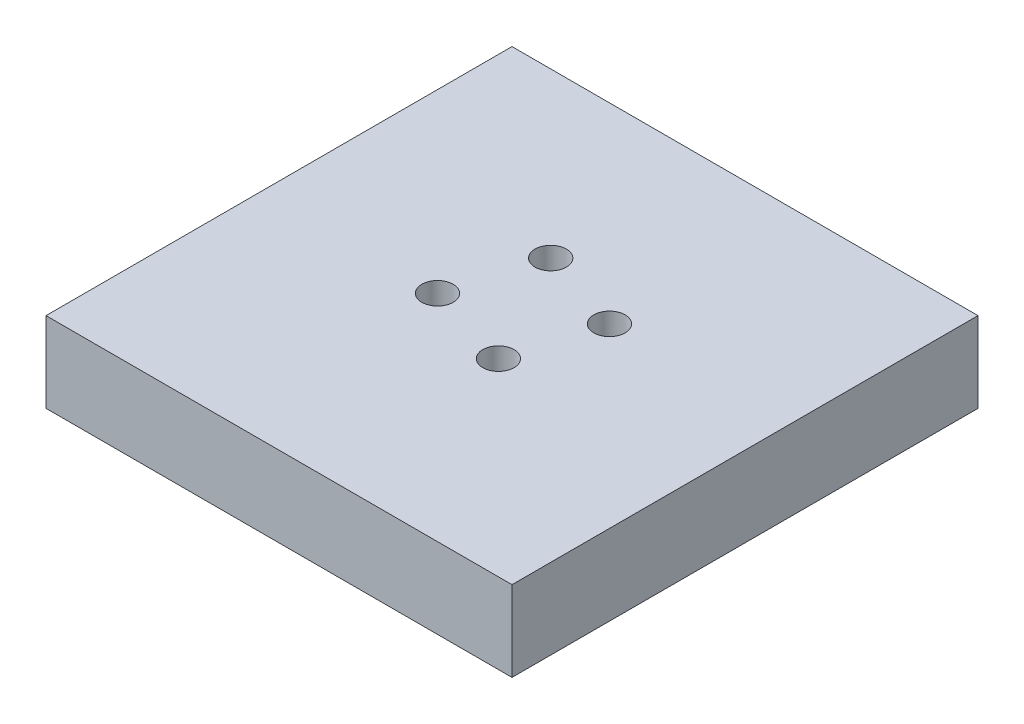
from build123d import *

# Parameters (mm, degrees)
SKETCH1_W           = 58
SKETCH1_H           = 58
BOSS_EXTRUDE1_DEPTH = 10
SKETCH2_R           = 2.5
CUT_EXTRUDE1_DEPTH  = 10
SKETCH7_R           = 1.95
CUT_EXTRUDE4_DEPTH  = 43.213741838


with BuildPart() as part:
    # Sketch1 → Boss-Extrude1 (new body)
    with BuildSketch(Plane(origin=(0, 0, 0), x_dir=(1, 0, 0), z_dir=(0, 1, 0))):
        Rectangle(SKETCH1_W, SKETCH1_H)
    extrude(amount=BOSS_EXTRUDE1_DEPTH)

    # Sketch2 → Cut-Extrude1 (cut)
    with BuildSketch(Plane.ZY.offset(29)):
        with Locations((0, 5)):
            Circle(SKETCH2_R)
    extrude(amount=-CUT_EXTRUDE1_DEPTH, mode=Mode.SUBTRACT)

    # Sketch7 → Cut-Extrude4 (cut, through all)
    with BuildSketch(Plane(origin=(0, 10, 0), x_dir=(1, 0, 0), z_dir=(0, 1, 0))):
        with Locations(Location((-3.791486316, 8.606059277, 0), (0, 0, 270))):
            Circle(SKETCH7_R)
        with Locations(Location((6.955184511, 5.175961247, 0), (0, 0, 270))):
            Circle(SKETCH7_R)
        with Locations(Location((-7.044475248, -2.229902286, 0), (0, 0, 270))):
            Circle(SKETCH7_R)
        with Locations(Location((3.791486316, -5.482891218, 0), (0, 0, 270))):
            Circle(SKETCH7_R)
    extrude(amount=-CUT_EXTRUDE4_DEPTH, mode=Mode.SUBTRACT)


solid = part.part
